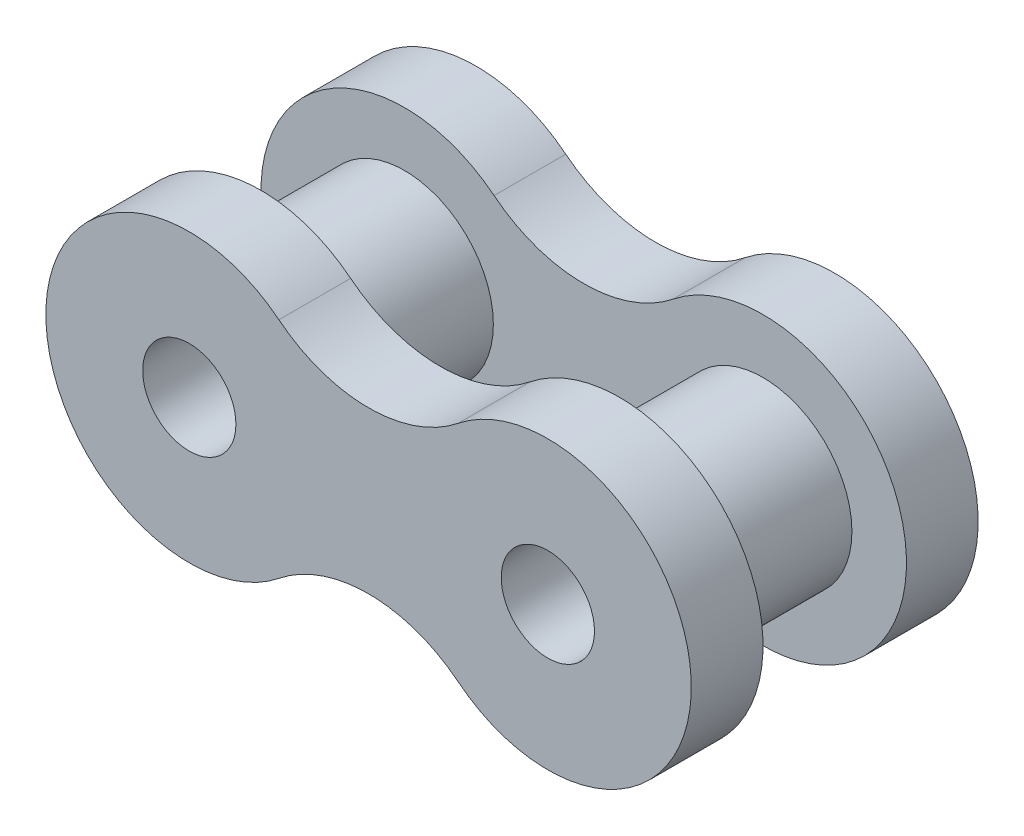
from build123d import *

# Parameters (mm, degrees)
SKETCH1_R             = 1.5748
BOSS_EXTRUDE1_DEPTH   = 1.27
BOSS_EXTRUDE1_2_DEPTH = 1.27
BOSS_EXTRUDE2_DEPTH   = 1.27
SKETCH3_R             = 0.8255
CUT_EXTRUDE1_DEPTH    = 5.08


with BuildPart() as part:
    # Sketch1 → Boss-Extrude1 (new, symmetric)
    with BuildSketch(Plane.XY):
        with Locations((3.175, 0)):
            Circle(SKETCH1_R)
    extrude(amount=BOSS_EXTRUDE1_DEPTH, both=True)



with BuildPart() as body_2:
    # Sketch1 → Boss-Extrude1 2 (new, symmetric)
    with BuildSketch(Plane.XY):
        with Locations((-3.175, 0)):
            Circle(SKETCH1_R)
    extrude(amount=BOSS_EXTRUDE1_2_DEPTH, both=True)


with BuildPart() as part_1:
    add(part.part)

    add(body_2.part)  # Boss-Extrude2 merges body 2
    # Sketch2 → Boss-Extrude2 (add)
    with BuildSketch(Plane.XY.offset(1.27)):
        with BuildLine():
            ThreePointArc((1.5875, -1.982786864), (5.715, 0), (1.5875, 1.982786864))
            ThreePointArc((1.5875, 1.982786864), (0, 1.425573729), (-1.5875, 1.982786864))
            ThreePointArc((-1.5875, 1.982786864), (-5.715, 0), (-1.5875, -1.982786864))
            ThreePointArc((-1.5875, -1.982786864), (0, -1.425573729), (1.5875, -1.982786864))
        make_face()
    boss_extrude2 = extrude(amount=BOSS_EXTRUDE2_DEPTH)

    # Mirror1: Boss-Extrude2 across plane
    add(boss_extrude2.mirror(Plane.XY))

    # Sketch3 → Cut-Extrude1 (cut)
    with BuildSketch(Plane.XY.offset(2.54)):
        with Locations((3.175, 0)):
            Circle(SKETCH3_R)
        with Locations((-3.175, 0)):
            Circle(SKETCH3_R)
    extrude(amount=-CUT_EXTRUDE1_DEPTH, mode=Mode.SUBTRACT)


solid = part_1.part
